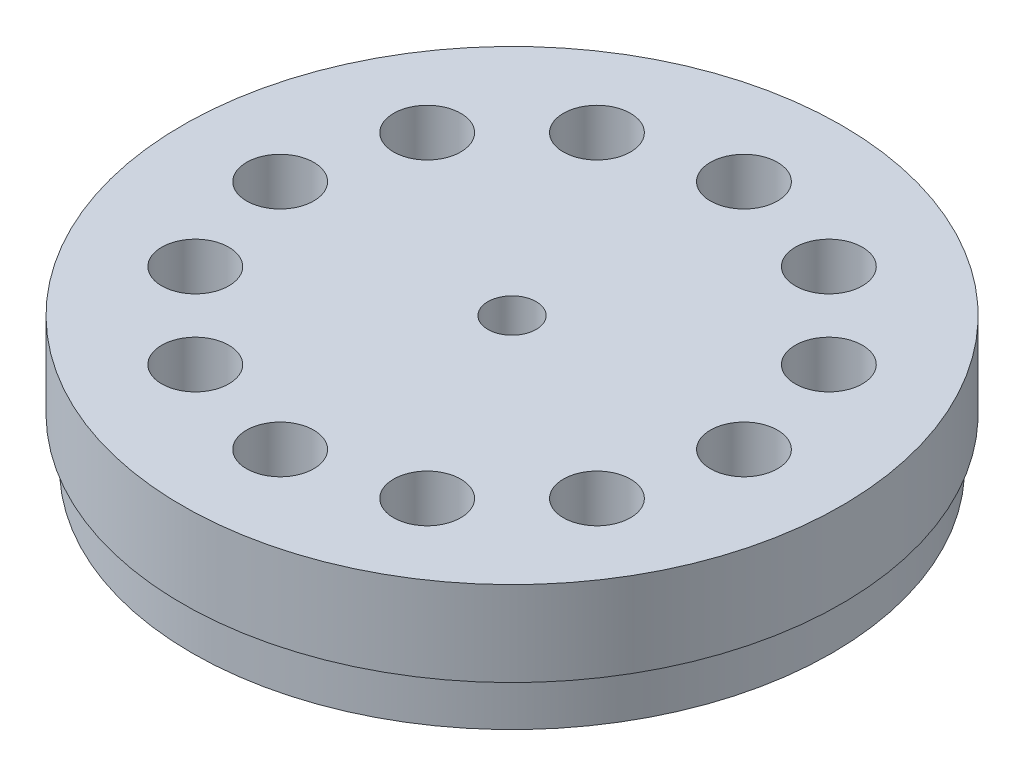
from build123d import *

# Parameters (mm, degrees)
CIRPATTERN1_COUNT         = 12
F_8_CLEARANCE_HOLE1_D     = 4.4958
F_8_CLEARANCE_HOLE1_DEPTH = 9.652
F_8_CLEARANCE_HOLE1_TIP   = 1.350674586


with BuildPart() as part:
    # Sketch1 → Revolve1 (revolve)
    with BuildSketch(Plane.XY, mode=Mode.PRIVATE) as revolve1_sk:
        Polygon((0, 0), (-30.6832, 0), (-30.6832, -7.8994), (-29.7942, -7.8994), (-29.7942, -12.319), (-26.1112, -12.319), (-26.1112, -6.223), (0, -6.223), align=None)
    revolve(revolve1_sk.sketch.rotate(Axis((0, -6.223, 0), (0, 1, 0)), 270), axis=Axis((0, -6.223, 0), (0, 1, 0)))

    # Sketch3 → D (0.246) Diameter Hole1 (revolve, cut)
    with BuildSketch(Plane(origin=(0, 0, -21.59), x_dir=(0, 0, 1), z_dir=(1, 0, 0))):
        Polygon((0, 0), (0, 14.577208746), (3.1242, 12.7), (3.1242, 0), align=None)
    d_0_246_diameter_hole1 = revolve(axis=Axis((0, 6.35, -21.59), (0, -1, 0)), mode=Mode.SUBTRACT)

    # CirPattern1: D (0.246) Diameter Hole1 ×12 about axis
    cirpattern1_axis = Axis((0, 0, 0), (0, 1, 0))
    for i in range(1, CIRPATTERN1_COUNT):
        add(d_0_246_diameter_hole1.rotate(cirpattern1_axis, i * 360 / CIRPATTERN1_COUNT), mode=Mode.SUBTRACT)

    # #8 Clearance Hole1
    with Locations(Plane.XZ.offset(6.223)):
        with Locations((0, 0)):
            Hole(F_8_CLEARANCE_HOLE1_D / 2, depth=F_8_CLEARANCE_HOLE1_DEPTH)
            with Locations((0, 0, -(F_8_CLEARANCE_HOLE1_DEPTH + F_8_CLEARANCE_HOLE1_TIP / 2))):  # 118° drill point
                Cone(0, F_8_CLEARANCE_HOLE1_D / 2, F_8_CLEARANCE_HOLE1_TIP, mode=Mode.SUBTRACT)


solid = part.part
